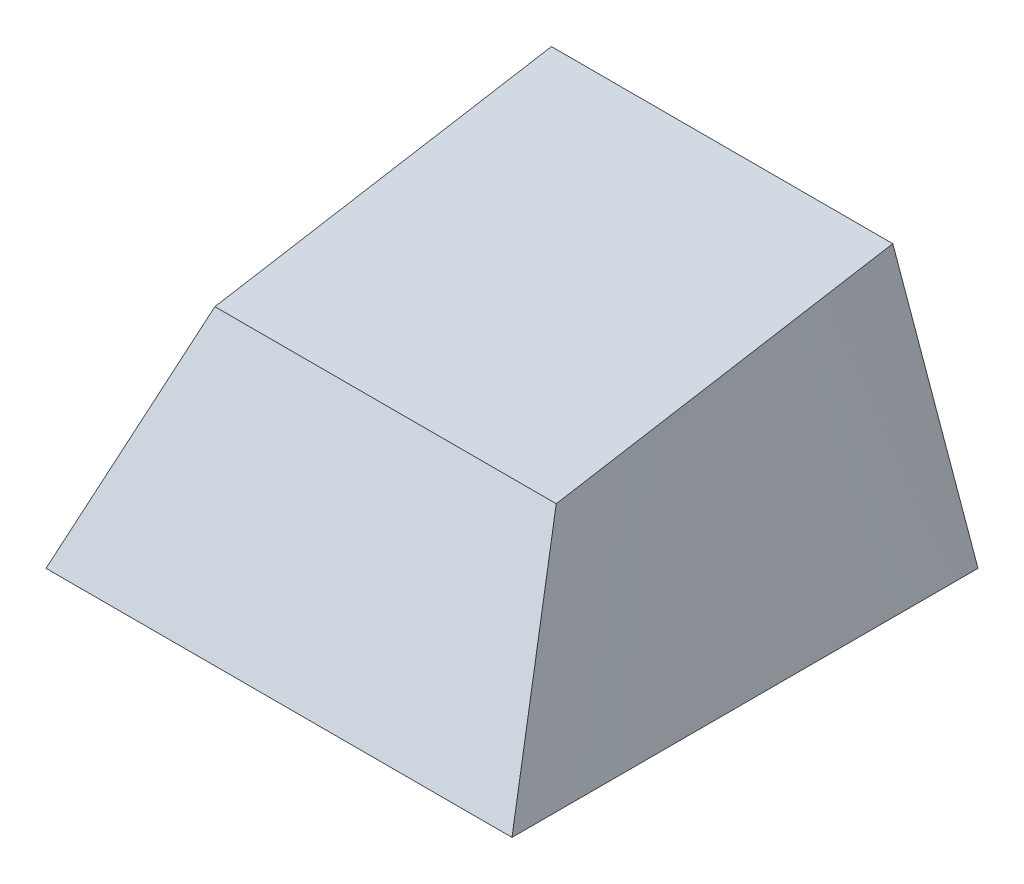
from build123d import *

# Parameters (mm, degrees)
SHELL1_T            = -1.6
BOSS_EXTRUDE1_REACH = 20.248
BOSS_EXTRUDE1_START = -2
SKETCH4_R           = 1.5
CUT_EXTRUDE1_REACH  = 17.087
SKETCH5_W           = 0.75
SKETCH5_H           = 1
SKETCH5_W_2         = 1
SKETCH5_H_2         = 0.75


with BuildPart() as part:
    # Sketch1 → Loft1 section 0
    with BuildSketch(Plane(origin=(0, 0, 0), x_dir=(1, 0, 0), z_dir=(0, 1, 0))):
        with BuildLine():
            Line((-9, 9), (9, 9))
            Line((9, 9), (9, -9))
            Line((9, -9), (-9, -9))
            Line((-9, -9), (-9, 9))
        make_face()
    # Sketch3 → Loft1 section 1
    with BuildSketch(Plane(origin=(0, 8.483501929, 1.435669557), x_dir=(0, 0.16685830369290802, -0.9859808854580931), z_dir=(0, 0.9859808854580931, 0.16685830369290802))):
        with BuildLine():
            Line((-3.496990657, 6.59241989), (9.687849122, 6.59241989))
            Line((9.687849122, 6.59241989), (9.687849122, -6.59241989))
            Line((9.687849122, -6.59241989), (-3.496990657, -6.59241989))
            Line((-3.496990657, -6.59241989), (-3.496990657, 6.59241989))
        make_face()
    loft()

    # Shell1
    shell1_openings = [part.faces().sort_by_distance(p)[0] for p in [
        (0, 0, 0),
    ]]
    offset(amount=SHELL1_T, openings=shell1_openings, kind=Kind.INTERSECTION)

    # Boss-Extrude1: up to this plane
    boss_extrude1_end = Plane(origin=(0, 6.905932512, 1.168696271), z_dir=(0, 0.9859808854580933, 0.16685830369290802))
    # Sketch4 → Boss-Extrude1 (add, up to the surface)
    with BuildSketch(Plane.XZ.offset(BOSS_EXTRUDE1_START), mode=Mode.PRIVATE) as boss_extrude1_sk1:
        with Locations(Location((0, 0, 0), (0, 0, 270))):
            Circle(SKETCH4_R)
    boss_extrude1_tool1 = split(extrude(boss_extrude1_sk1.sketch, amount=-BOSS_EXTRUDE1_REACH, mode=Mode.PRIVATE), bisect_by=boss_extrude1_end, keep=Keep.BOTH, mode=Mode.PRIVATE)
    add(boss_extrude1_tool1.solids().sort_by_distance((0, 2, 0))[0])

    # Cut-Extrude1: up to this plane
    cut_extrude1_end = Plane(origin=(0, 6.41294207, 1.085267119), z_dir=(0, 0.9859808854580933, 0.16685830369290802))
    # Sketch5 → Cut-Extrude1 (cut, up to the surface)
    with BuildSketch(Plane.XZ.offset(-2), mode=Mode.PRIVATE) as cut_extrude1_sk1:
        with Locations((-0.875, 0)):
            Rectangle(SKETCH5_W, SKETCH5_H)
    cut_extrude1_tool1 = split(extrude(cut_extrude1_sk1.sketch, amount=-CUT_EXTRUDE1_REACH, mode=Mode.PRIVATE), bisect_by=cut_extrude1_end, keep=Keep.BOTH, mode=Mode.PRIVATE)
    add(cut_extrude1_tool1.solids().sort_by_distance((-0.875, 2, 0))[0], mode=Mode.SUBTRACT)
    # Sketch5 → Cut-Extrude1 (cut, up to the surface)
    with BuildSketch(Plane.XZ.offset(-2), mode=Mode.PRIVATE) as cut_extrude1_sk2:
        Rectangle(SKETCH5_W_2, SKETCH5_H)
    cut_extrude1_tool2 = split(extrude(cut_extrude1_sk2.sketch, amount=-CUT_EXTRUDE1_REACH, mode=Mode.PRIVATE), bisect_by=cut_extrude1_end, keep=Keep.BOTH, mode=Mode.PRIVATE)
    add(cut_extrude1_tool2.solids().sort_by_distance((0, 2, 0))[0], mode=Mode.SUBTRACT)
    # Sketch5 → Cut-Extrude1 (cut, up to the surface)
    with BuildSketch(Plane.XZ.offset(-2), mode=Mode.PRIVATE) as cut_extrude1_sk3:
        with Locations((0, 0.875)):
            Rectangle(SKETCH5_W_2, SKETCH5_H_2)
    cut_extrude1_tool3 = split(extrude(cut_extrude1_sk3.sketch, amount=-CUT_EXTRUDE1_REACH, mode=Mode.PRIVATE), bisect_by=cut_extrude1_end, keep=Keep.BOTH, mode=Mode.PRIVATE)
    add(cut_extrude1_tool3.solids().sort_by_distance((0, 2, 0.875))[0], mode=Mode.SUBTRACT)
    # Sketch5 → Cut-Extrude1 (cut, up to the surface)
    with BuildSketch(Plane.XZ.offset(-2), mode=Mode.PRIVATE) as cut_extrude1_sk4:
        with Locations((0.875, 0)):
            Rectangle(SKETCH5_W, SKETCH5_H)
    cut_extrude1_tool4 = split(extrude(cut_extrude1_sk4.sketch, amount=-CUT_EXTRUDE1_REACH, mode=Mode.PRIVATE), bisect_by=cut_extrude1_end, keep=Keep.BOTH, mode=Mode.PRIVATE)
    add(cut_extrude1_tool4.solids().sort_by_distance((0.875, 2, 0))[0], mode=Mode.SUBTRACT)
    # Sketch5 → Cut-Extrude1 (cut, up to the surface)
    with BuildSketch(Plane.XZ.offset(-2), mode=Mode.PRIVATE) as cut_extrude1_sk5:
        with Locations((0, -0.875)):
            Rectangle(SKETCH5_W_2, SKETCH5_H_2)
    cut_extrude1_tool5 = split(extrude(cut_extrude1_sk5.sketch, amount=-CUT_EXTRUDE1_REACH, mode=Mode.PRIVATE), bisect_by=cut_extrude1_end, keep=Keep.BOTH, mode=Mode.PRIVATE)
    add(cut_extrude1_tool5.solids().sort_by_distance((0, 2, -0.875))[0], mode=Mode.SUBTRACT)


solid = part.part
